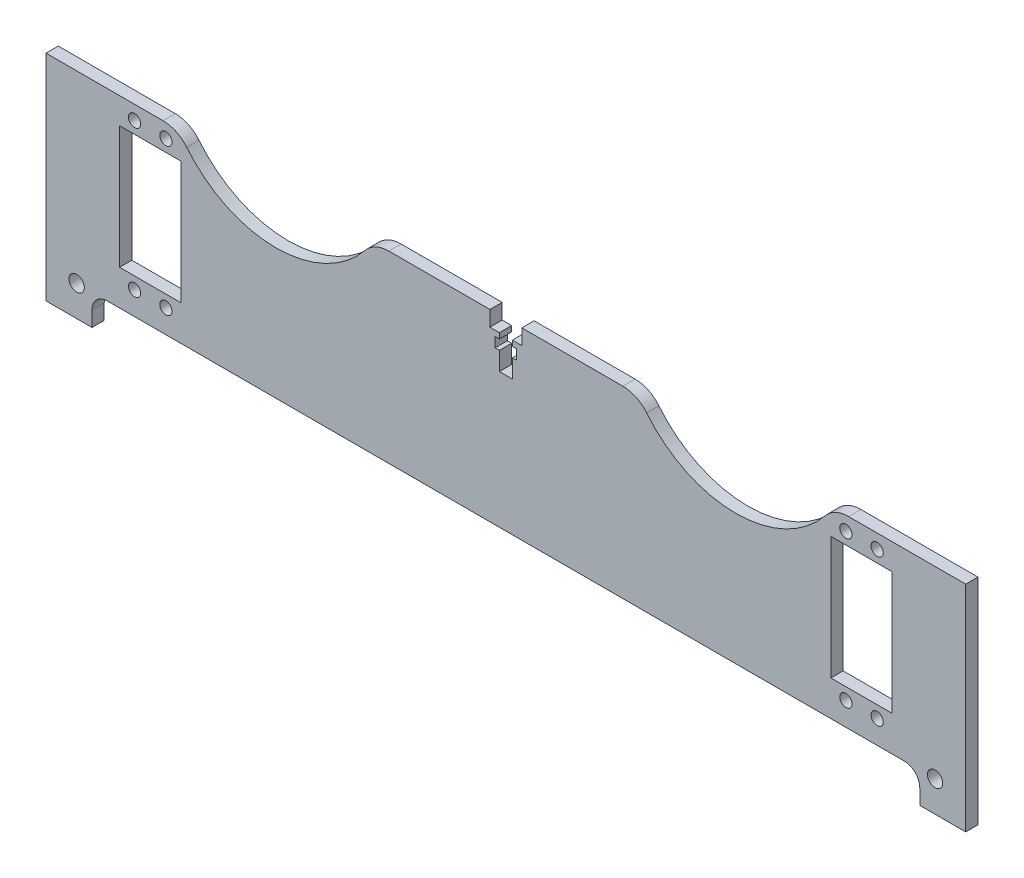
from build123d import *

# Parameters (mm, degrees)
ESQUISSE1_W             = 300
ESQUISSE1_H             = 70
BOSS_EXTRU_1_DEPTH      = 4
ESQUISSE2_R             = 2.5
ENL_V_MAT_EXTRU_1_DEPTH = 155.081147452
ESQUISSE3_R             = 37.5
ENL_V_MAT_EXTRU_2_DEPTH = 155.081147452
CONG_1_R                = 10
ESQUISSE4_R             = 2
ESQUISSE4_W             = 20
ESQUISSE4_H             = 40
ENL_V_MAT_EXTRU_3_DEPTH = 155.081147452
CONG_2_R                = 5
ESQUISSE5_W             = 10.4
ESQUISSE5_H             = 4.4
ENL_V_MAT_EXTRU_4_DEPTH = 5
ENL_V_MAT_EXTRU_5_DEPTH = 155.081147452


with BuildPart() as part:
    # Esquisse1 → Boss.-Extru.1 (new body)
    with BuildSketch(Plane.XY):
        Rectangle(ESQUISSE1_W, ESQUISSE1_H)
    extrude(amount=BOSS_EXTRU_1_DEPTH)

    # Esquisse2 → Enlèv. mat.-Extru.1 (cut, through all)
    with BuildSketch(Plane.XY.offset(4)):
        with Locations((140, -25)):
            Circle(ESQUISSE2_R)
        with Locations(Location((-140, -25, 0), (0, 0, 180))):
            Circle(ESQUISSE2_R)
        Polygon((-135, -25), (0, -25), (135, -25), (135, -35), (0, -35), (-135, -35), align=None)
    extrude(amount=-ENL_V_MAT_EXTRU_1_DEPTH, mode=Mode.SUBTRACT)

    # Esquisse3 → Enlèv. mat.-Extru.2 (cut, through all)
    with BuildSketch(Plane(origin=(0, 0, 0), x_dir=(-1, 0, 0), z_dir=(0, 0, -1))):
        with Locations((75, 55)):
            Circle(ESQUISSE3_R)
        with Locations((-75, 55)):
            Circle(ESQUISSE3_R)
    extrude(amount=-ENL_V_MAT_EXTRU_2_DEPTH, mode=Mode.SUBTRACT)

    # Congé1
    cong_1_edges = [part.edges().sort_by_distance(p)[0] for p in [
        (-106.721443851, 35, 2),
        (-43.278556149, 35, 2),
        (43.278556149, 35, 2),
        (106.721443851, 35, 2),
    ]]
    fillet(cong_1_edges, radius=CONG_1_R)

    # Esquisse4 → Enlèv. mat.-Extru.3 (cut, through all)
    with BuildSketch(Plane.XY.offset(4)):
        with Locations((-110.9, 30.4)):
            Circle(ESQUISSE4_R)
        with Locations((-121.1, 30.4)):
            Circle(ESQUISSE4_R)
        with Locations((-110.9, -17.4)):
            Circle(ESQUISSE4_R)
        with Locations((-121.1, -17.4)):
            Circle(ESQUISSE4_R)
        with Locations(Location((121.1, -17.4, 0), (0, 0, 180))):
            Circle(ESQUISSE4_R)
        with Locations(Location((110.9, -17.4, 0), (0, 0, 180))):
            Circle(ESQUISSE4_R)
        with Locations(Location((121.1, 30.4, 0), (0, 0, 180))):
            Circle(ESQUISSE4_R)
        with Locations(Location((110.9, 30.4, 0), (0, 0, 180))):
            Circle(ESQUISSE4_R)
        with Locations((-116, 6.5)):
            Rectangle(ESQUISSE4_W, ESQUISSE4_H)
        with Locations((116, 6.5)):
            Rectangle(ESQUISSE4_W, ESQUISSE4_H)
    extrude(amount=-ENL_V_MAT_EXTRU_3_DEPTH, mode=Mode.SUBTRACT)

    # Congé2
    cong_2_edges = [part.edges().sort_by_distance(p)[0] for p in [
        (-135, -25, 2),
        (135, -25, 2),
    ]]
    fillet(cong_2_edges, radius=CONG_2_R)

    # Esquisse5 → Enlèv. mat.-Extru.4 (cut)
    with BuildSketch(Plane(origin=(0, 35, 0), x_dir=(1, 0, 0), z_dir=(0, 1, 0))):
        with Locations((0, -2)):
            Rectangle(ESQUISSE5_W, ESQUISSE5_H)
    extrude(amount=-ENL_V_MAT_EXTRU_4_DEPTH, mode=Mode.SUBTRACT)

    # Esquisse6 → Enlèv. mat.-Extru.5 (cut, through all)
    with BuildSketch(Plane(origin=(0, 0, 0), x_dir=(-1, 0, 0), z_dir=(0, 0, -1))):
        Polygon((-2.1, 30), (2.1, 30), (2.1, 28.2), (3.5, 28.2), (3.5, 25), (2.1, 25), (2.1, 19), (-2.1, 19), (-2.1, 25), (-3.5, 25), (-3.5, 28.2), (-2.1, 28.2), align=None)
    extrude(amount=-ENL_V_MAT_EXTRU_5_DEPTH, mode=Mode.SUBTRACT)


solid = part.part
